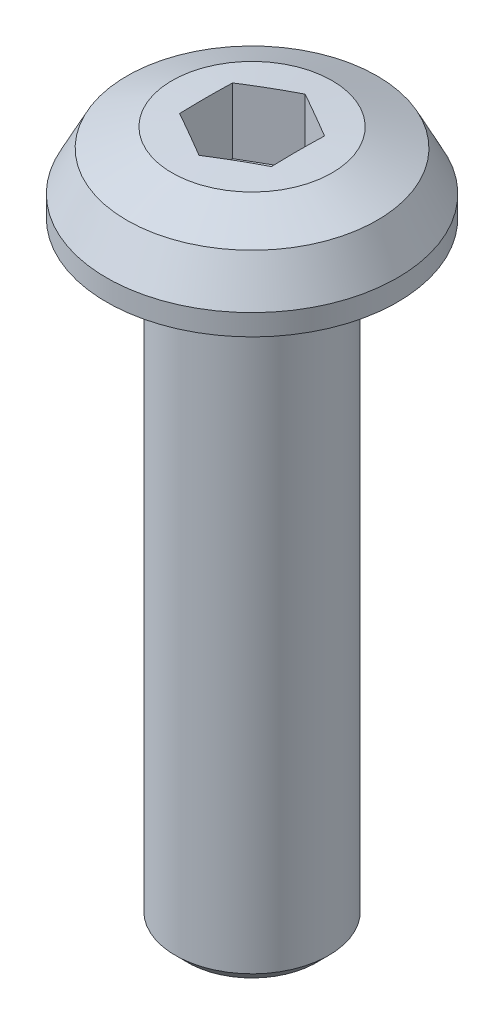
from build123d import *

# Parameters (mm, degrees)
CUT_EXTRUDE1_DEPTH = 2.25


with BuildPart() as part:
    # Sketch1 → Revolve1 (revolve)
    with BuildSketch(Plane.XY, mode=Mode.PRIVATE) as revolve1_sk:
        Polygon((0, -20), (2.1, -20), (2.5, -19.6), (2.5, 0), (4.75, 0), (4.75, 0.6875), (4.085, 1.98), (2.6125, 2.585), (0, 2.75), align=None)
    revolve(revolve1_sk.sketch.rotate(Axis((0, -10, 0), (0, 1, 0)), 90), axis=Axis((0, -10, 0), (0, 1, 0)))

    # Sketch2 → Cut-Extrude1 (cut)
    with BuildSketch(Plane(origin=(0, 2.75, 0), x_dir=(1, 0, 0), z_dir=(0, 1, 0))):
        Polygon((1.5, -0.866025404), (0, -1.732050808), (-1.5, -0.866025404), (-1.5, 0.866025404), (0, 1.732050808), (1.5, 0.866025404), align=None)
    extrude(amount=-CUT_EXTRUDE1_DEPTH, mode=Mode.SUBTRACT)


solid = part.part
